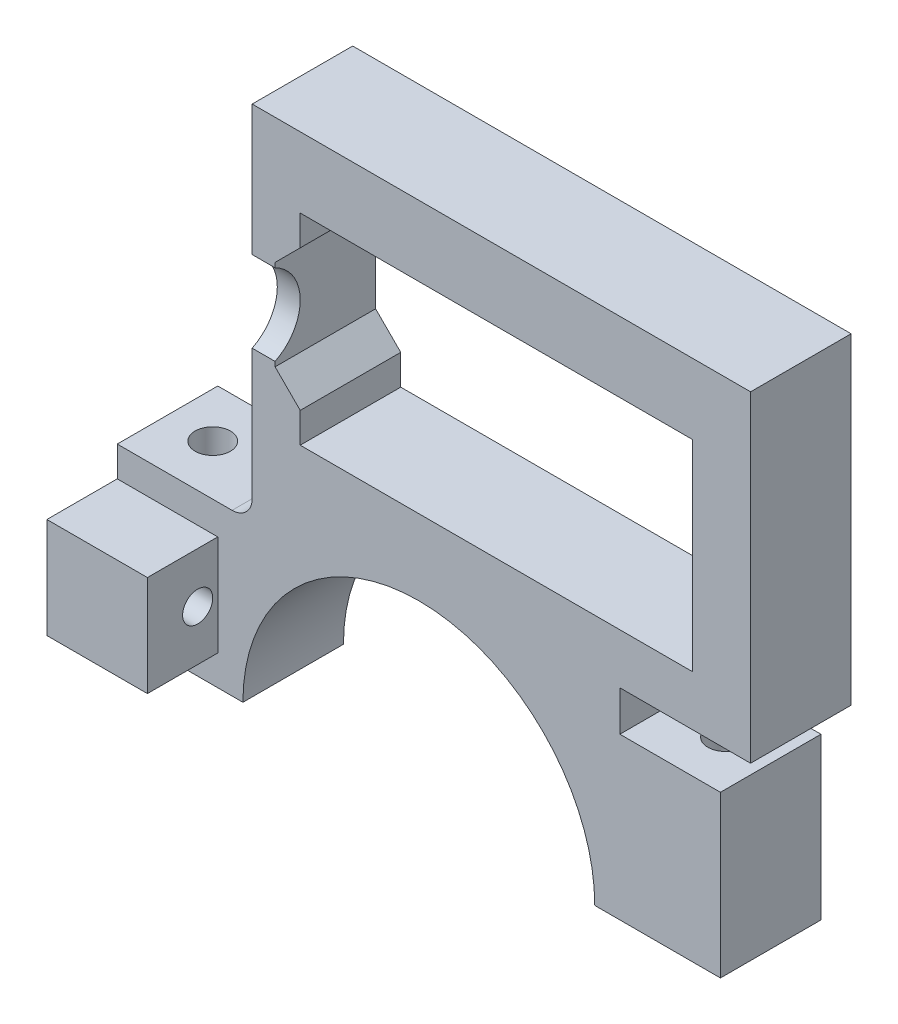
from build123d import *

# Parameters (mm, degrees)
Y_KSEKLIK_EKSTR_ZYON1_DEPTH = 10
CUT_EXTRUDE1_REACH          = 62.86
SKETCH1_W                   = 10
SKETCH1_H                   = 4
SKETCH1_H_2                 = 36
CUT_EXTRUDE2_REACH          = 49.917
SKETCH2_R                   = 1.75
SKETCH3_W                   = 10
SKETCH3_H                   = 10
BOSS_EXTRUDE1_DEPTH         = 7
CUT_EXTRUDE3_REACH          = 83.197
SKETCH4_R                   = 1.5
CUT_EXTRUDE4_REACH          = 62.86
CUT_EXTRUDE5_REACH          = 73.851
SKETCH7_R                   = 4.5
SKETCH8_W                   = 10
SKETCH8_H                   = 32
BOSS_EXTRUDE2_DEPTH         = 3


with BuildPart() as part:
    # Çizim1 → Yükseklik-Ekstrüzyon1 (new body)
    with BuildSketch(Plane.XY):
        with BuildLine():
            Line((-30, 0), (-17.5, 0))
            ThreePointArc((-17.5, 0), (0, 17.5), (17.5, 0))
            Line((17.5, 0), (30, 0))
            Line((30, 0), (30, 52))
            Line((30, 52), (-30, 52))
            Line((-30, 52), (-30, 0))
        make_face()
    extrude(amount=Y_KSEKLIK_EKSTR_ZYON1_DEPTH)

    # Sketch1 → Cut-Extrude1 (cut, up to next)
    with BuildSketch(Plane.XY.offset(10), mode=Mode.PRIVATE) as cut_extrude1_sk1:
        with Locations((25, 18)):
            Rectangle(SKETCH1_W, SKETCH1_H)
    cut_extrude1_tool1 = extrude(cut_extrude1_sk1.sketch, amount=-CUT_EXTRUDE1_REACH, mode=Mode.PRIVATE) & part.part
    # Sketch1 → Cut-Extrude1 (cut, up to next)
    with BuildSketch(Plane.XY.offset(10), mode=Mode.PRIVATE) as cut_extrude1_sk2:
        with Locations((-25, 34)):
            Rectangle(SKETCH1_W, SKETCH1_H_2)
    cut_extrude1_tool2 = extrude(cut_extrude1_sk2.sketch, amount=-CUT_EXTRUDE1_REACH, mode=Mode.PRIVATE) & part.part
    add(cut_extrude1_tool1.solids().sort_by_distance((25, 18, 10))[0], mode=Mode.SUBTRACT)
    add(cut_extrude1_tool2.solids().sort_by_distance((-25, 34, 10))[0], mode=Mode.SUBTRACT)

    # Sketch2 → Cut-Extrude2 (cut, up to next)
    with BuildSketch(Plane(origin=(0, 16, 0), x_dir=(1, 0, 0), z_dir=(0, 1, 0)), mode=Mode.PRIVATE) as cut_extrude2_sk1:
        with Locations(Location((-25.5, -5, 0), (0, 0, 180))):
            Circle(SKETCH2_R)
    cut_extrude2_tool1 = extrude(cut_extrude2_sk1.sketch, amount=-CUT_EXTRUDE2_REACH, mode=Mode.PRIVATE) & part.part
    # Sketch2 → Cut-Extrude2 (cut, up to next)
    with BuildSketch(Plane(origin=(0, 16, 0), x_dir=(1, 0, 0), z_dir=(0, 1, 0)), mode=Mode.PRIVATE) as cut_extrude2_sk2:
        with Locations(Location((25.5, -5, 0), (0, 0, 180))):
            Circle(SKETCH2_R)
    cut_extrude2_tool2 = extrude(cut_extrude2_sk2.sketch, amount=-CUT_EXTRUDE2_REACH, mode=Mode.PRIVATE) & part.part
    add(cut_extrude2_tool1.solids().sort_by_distance((-25.5, 16, 5))[0], mode=Mode.SUBTRACT)
    add(cut_extrude2_tool2.solids().sort_by_distance((25.5, 16, 5))[0], mode=Mode.SUBTRACT)

    # Sketch3 → Boss-Extrude1 (add)
    with BuildSketch(Plane.XY.offset(10)):
        with Locations((-25, 8)):
            Rectangle(SKETCH3_W, SKETCH3_H)
    extrude(amount=BOSS_EXTRUDE1_DEPTH)

    # Sketch4 → Cut-Extrude3 (cut, up to next)
    with BuildSketch(Plane.ZY.offset(30), mode=Mode.PRIVATE) as cut_extrude3_sk1:
        with Locations((12, 8)):
            Circle(SKETCH4_R)
    cut_extrude3_tool1 = extrude(cut_extrude3_sk1.sketch, amount=-CUT_EXTRUDE3_REACH, mode=Mode.PRIVATE) & part.part
    add(cut_extrude3_tool1.solids().sort_by_distance((-30, 8, 12))[0], mode=Mode.SUBTRACT)

    # Sketch6 → Cut-Extrude4 (cut, up to next)
    with BuildSketch(Plane.XY.offset(10), mode=Mode.PRIVATE) as cut_extrude4_sk1:
        with BuildLine():
            Line((-20, 52), (-16.579251378, 52))
            Line((-16.579251378, 52), (-16.579251378, 18))
            ThreePointArc((-16.579251378, 18), (-17.165037815, 16.585786438), (-18.579251378, 16))
            Line((-18.579251378, 16), (-20, 16))
            Line((-20, 16), (-20, 52))
        make_face()
    cut_extrude4_tool1 = extrude(cut_extrude4_sk1.sketch, amount=-CUT_EXTRUDE4_REACH, mode=Mode.PRIVATE) & part.part
    # Sketch6 → Cut-Extrude4 (cut, up to next)
    with BuildSketch(Plane.XY.offset(10), mode=Mode.PRIVATE) as cut_extrude4_sk2:
        Polygon((27.2, 45), (-11.8, 45), (-11.8, 42), (-14.3, 39.5), (-14.3, 30.5), (-11.8, 28), (-11.8, 25), (27.2, 25), align=None)
    cut_extrude4_tool2 = extrude(cut_extrude4_sk2.sketch, amount=-CUT_EXTRUDE4_REACH, mode=Mode.PRIVATE) & part.part
    add(cut_extrude4_tool1.solids().sort_by_distance((-18.298496, 34.123216, 10))[0], mode=Mode.SUBTRACT)
    add(cut_extrude4_tool2.solids().sort_by_distance((6.965585, 35, 10))[0], mode=Mode.SUBTRACT)

    # Sketch7 → Cut-Extrude5 (cut, up to next)
    with BuildSketch(Plane.ZY.offset(16.579251378), mode=Mode.PRIVATE) as cut_extrude5_sk1:
        with Locations((12, 35)):
            Circle(SKETCH7_R)
    cut_extrude5_tool1 = extrude(cut_extrude5_sk1.sketch, amount=-CUT_EXTRUDE5_REACH, mode=Mode.PRIVATE) & part.part
    add(cut_extrude5_tool1.solids().sort_by_distance((-16.579251, 35, 12))[0], mode=Mode.SUBTRACT)

    # Sketch8 → Boss-Extrude2 (add)
    with BuildSketch(Plane(origin=(30, 0, 0), x_dir=(0, 0, -1), z_dir=(1, 0, 0))):
        with Locations((-5, 36)):
            Rectangle(SKETCH8_W, SKETCH8_H)
    extrude(amount=BOSS_EXTRUDE2_DEPTH)


solid = part.part
